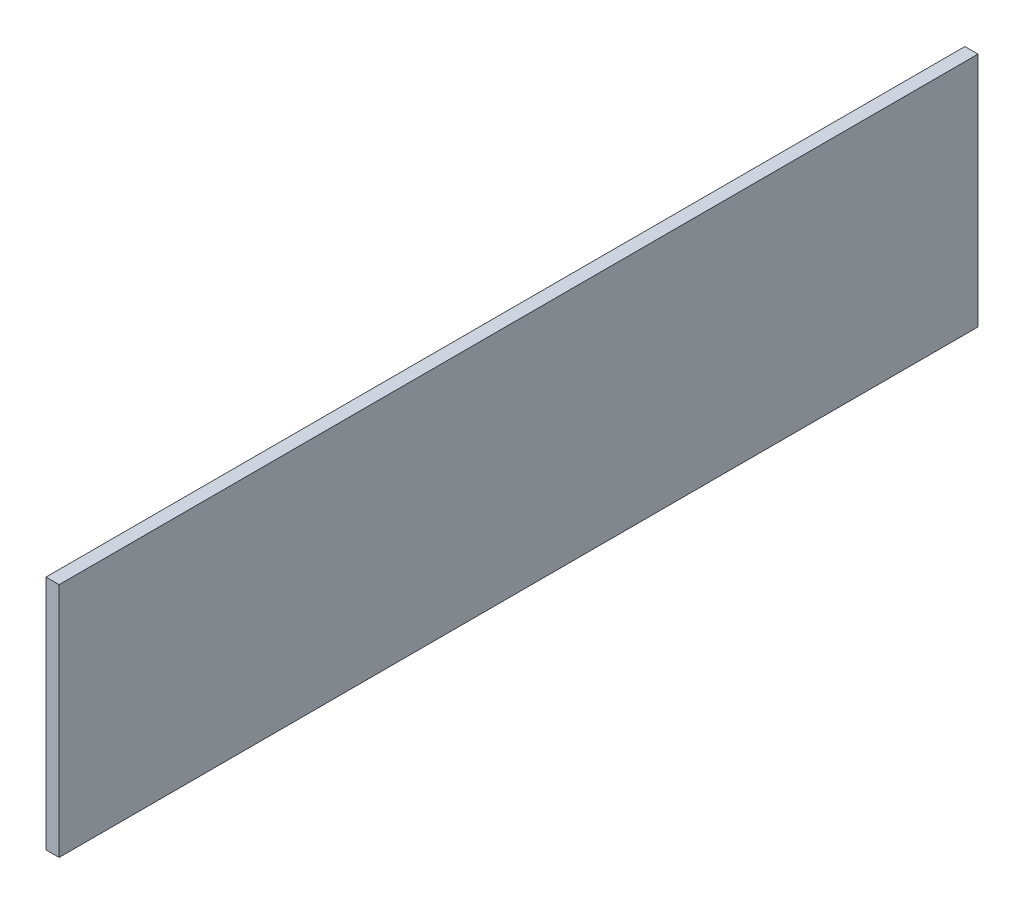
from build123d import *

# Parameters (mm, degrees)
SKETCH2_W           = 70
SKETCH2_H           = 18
BOSS_EXTRUDE1_DEPTH = 1


with BuildPart() as part:
    # Sketch2 → Boss-Extrude1 (new body)
    with BuildSketch(Plane(origin=(0, 0, 0), x_dir=(0, 0, -1), z_dir=(1, 0, 0))):
        with Locations((35, 9)):
            Rectangle(SKETCH2_W, SKETCH2_H)
    extrude(amount=BOSS_EXTRUDE1_DEPTH)


solid = part.part
